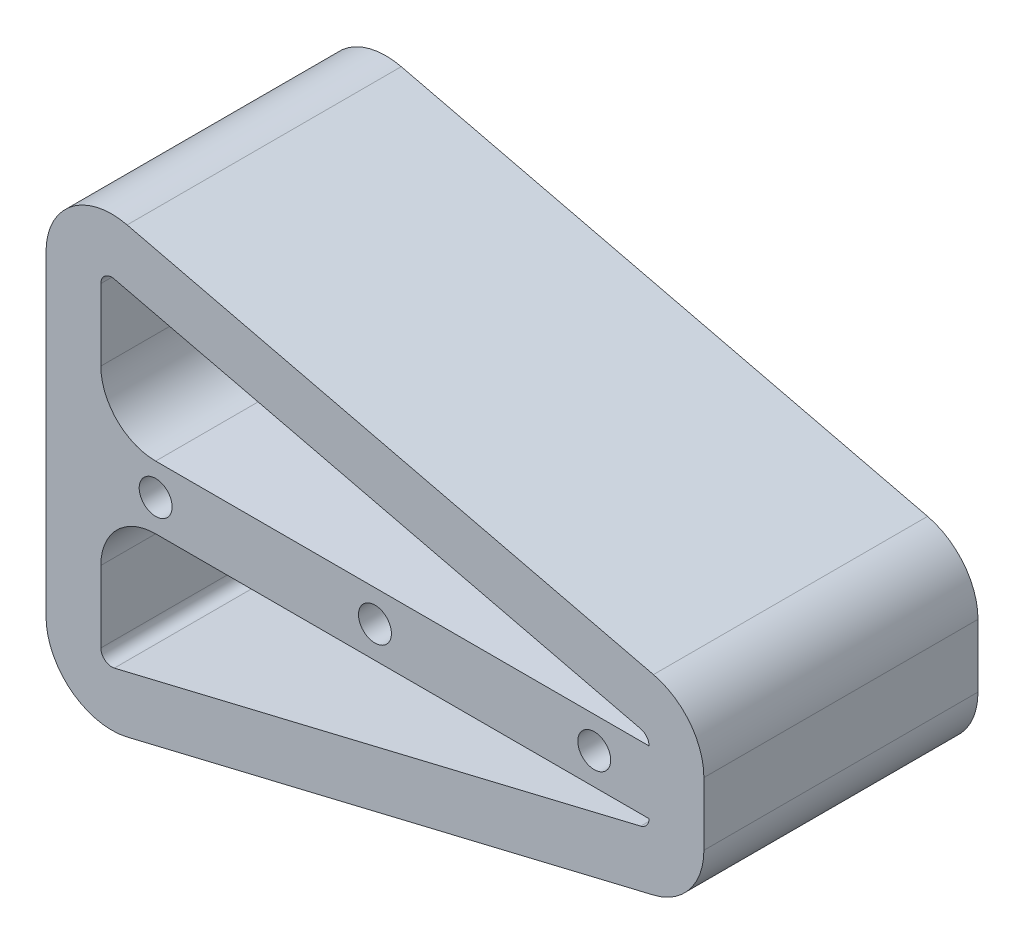
from build123d import *

# Parameters (mm, degrees)
SKETCH1_R           = 1.5
BOSS_EXTRUDE1_DEPTH = 25
FILLET1_R           = 5


with BuildPart() as part:
    # Sketch1 → Boss-Extrude1 (new body)
    with BuildSketch(Plane.XY):
        with BuildLine():
            Line((45, 14.389938011), (45, -14.389938011))
            ThreePointArc((45, -14.389938011), (47.285164876, -19.101625607), (52.4, -20.224318869))
            Line((52.4, -20.224318869), (100.4, -8.70638721))
            ThreePointArc((100.4, -8.70638721), (103.711687596, -6.586841476), (105, -2.872006352))
            Line((105, -2.872006352), (105, 2.872006352))
            ThreePointArc((105, 2.872006352), (103.711687596, 6.586841476), (100.4, 8.70638721))
            Line((100.4, 8.70638721), (52.4, 20.224318869))
            ThreePointArc((52.4, 20.224318869), (47.285164876, 19.101625607), (45, 14.389938011))
        make_face()
        with Locations((75, 0)):
            Circle(SKETCH1_R, mode=Mode.SUBTRACT)
        with Locations((95, 0)):
            Circle(SKETCH1_R, mode=Mode.SUBTRACT)
        with Locations((55, 0)):
            Circle(SKETCH1_R, mode=Mode.SUBTRACT)
        with BuildLine():
            Line((51.233333333, 15.362334821), (99.233333333, 3.844403161))
            ThreePointArc((99.233333333, 3.844403161), (99.785281266, 3.491145539), (100, 2.872006352))
            Line((100, 2.872006352), (50, 2.872006352))
            Line((50, 2.872006352), (50, 14.389938011))
            ThreePointArc((50, 14.389938011), (50.380860813, 15.175219277), (51.233333333, 15.362334821))
        make_face(mode=Mode.SUBTRACT)
        with BuildLine():
            Line((51.233333333, -15.362334821), (99.233333333, -3.844403161))
            ThreePointArc((99.233333333, -3.844403161), (99.785281266, -3.491145539), (100, -2.872006352))
            Line((100, -2.872006352), (50, -2.872006352))
            Line((50, -2.872006352), (50, -14.389938011))
            ThreePointArc((50, -14.389938011), (50.380860813, -15.175219277), (51.233333333, -15.362334821))
        make_face(mode=Mode.SUBTRACT)
    extrude(amount=BOSS_EXTRUDE1_DEPTH)

    # Fillet1
    fillet1_edges = [part.edges().sort_by_distance(p)[0] for p in [
        (50, -2.872006352, 12.5),
        (50, 2.872006352, 12.5),
    ]]
    fillet(fillet1_edges, radius=FILLET1_R)


solid = part.part
